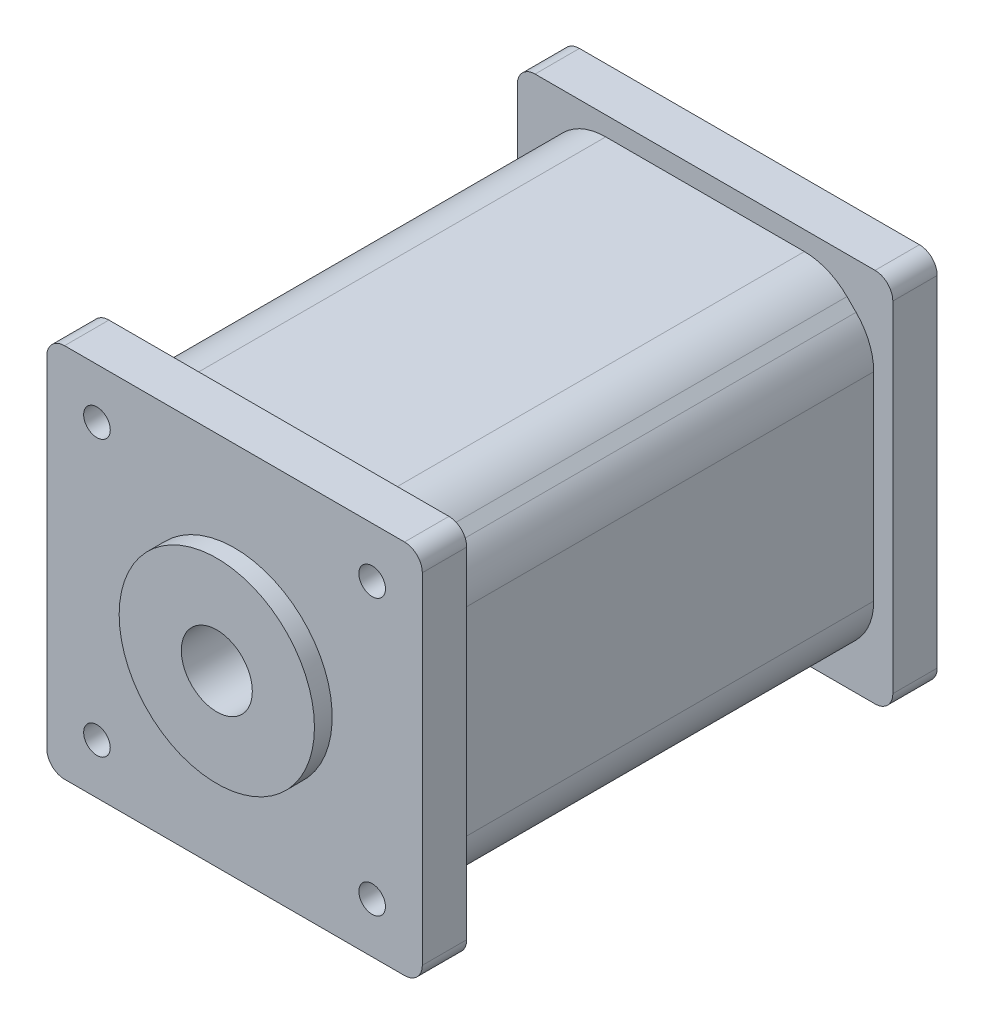
from build123d import *

# Parameters (mm, degrees)
EXTRUDE_1_DEPTH     = 5
EXTRUDE_2_DEPTH     = 48
EXTRUDE_4_DEPTH     = 5
SKETCH_4_R          = 1.5
CUT_EXTRUDE_1_DEPTH = 4.5
SKETCH_5_R          = 11
EXTRUDE_5_DEPTH     = 2
SKETCH_6_R          = 4
CUT_EXTRUDE_2_DEPTH = 20


with BuildPart() as part:
    # 草图1 → 凸台-拉伸1 (new body)
    with BuildSketch(Plane.XY):
        with BuildLine():
            Line((-19.15, -21.15), (19.15, -21.15))
            ThreePointArc((19.15, -21.15), (20.564213562, -20.564213562), (21.15, -19.15))
            Line((21.15, -19.15), (21.15, 19.15))
            ThreePointArc((21.15, 19.15), (20.564213562, 20.564213562), (19.15, 21.15))
            Line((19.15, 21.15), (-19.15, 21.15))
            ThreePointArc((-19.15, 21.15), (-20.564213562, 20.564213562), (-21.15, 19.15))
            Line((-21.15, 19.15), (-21.15, -19.15))
            ThreePointArc((-21.15, -19.15), (-20.564213562, -20.564213562), (-19.15, -21.15))
        make_face()
    extrude(amount=EXTRUDE_1_DEPTH)

    # 草图2 → 凸台-拉伸2 (add)
    with BuildSketch(Plane.XY.offset(5)):
        with BuildLine():
            Line((-17.011566207, 15.988433793), (-15.988433793, 17.011566207))
            ThreePointArc((-15.988433793, 17.011566207), (-13.785943914, 18.483222894), (-11.187929962, 19))
            Line((-11.187929962, 19), (11.187929962, 19))
            ThreePointArc((11.187929962, 19), (13.785943914, 18.483222894), (15.988433793, 17.011566207))
            Line((15.988433793, 17.011566207), (17.011566207, 15.988433793))
            ThreePointArc((17.011566207, 15.988433793), (18.483222894, 13.785943914), (19, 11.187929962))
            Line((19, 11.187929962), (19, -11.187929962))
            ThreePointArc((19, -11.187929962), (18.483222894, -13.785943914), (17.011566207, -15.988433793))
            Line((17.011566207, -15.988433793), (15.988433793, -17.011566207))
            ThreePointArc((15.988433793, -17.011566207), (13.785943914, -18.483222894), (11.187929962, -19))
            Line((11.187929962, -19), (-11.187929962, -19))
            ThreePointArc((-11.187929962, -19), (-13.785943914, -18.483222894), (-15.988433793, -17.011566207))
            Line((-15.988433793, -17.011566207), (-17.011566207, -15.988433793))
            ThreePointArc((-17.011566207, -15.988433793), (-18.483222894, -13.785943914), (-19, -11.187929962))
            Line((-19, -11.187929962), (-19, 11.187929962))
            ThreePointArc((-19, 11.187929962), (-18.483222894, 13.785943914), (-17.011566207, 15.988433793))
        make_face()
    extrude(amount=EXTRUDE_2_DEPTH)

    # 草图3 → 凸台-拉伸4 (add)
    with BuildSketch(Plane.XY.offset(53)):
        with BuildLine():
            Line((-19.15, -21.15), (19.15, -21.15))
            ThreePointArc((19.15, -21.15), (20.564213562, -20.564213562), (21.15, -19.15))
            Line((21.15, -19.15), (21.15, 19.15))
            ThreePointArc((21.15, 19.15), (20.564213562, 20.564213562), (19.15, 21.15))
            Line((19.15, 21.15), (-19.15, 21.15))
            ThreePointArc((-19.15, 21.15), (-20.564213562, 20.564213562), (-21.15, 19.15))
            Line((-21.15, 19.15), (-21.15, -19.15))
            ThreePointArc((-21.15, -19.15), (-20.564213562, -20.564213562), (-19.15, -21.15))
        make_face()
    extrude(amount=EXTRUDE_4_DEPTH)

    # 草图4 → 切除-拉伸1 (cut)
    with BuildSketch(Plane.XY.offset(58)):
        with Locations((15.5, 15.5)):
            Circle(SKETCH_4_R)
        with Locations((15.5, -15.5)):
            Circle(SKETCH_4_R)
        with Locations((-15.5, -15.5)):
            Circle(SKETCH_4_R)
        with Locations((-15.5, 15.5)):
            Circle(SKETCH_4_R)
    extrude(amount=-CUT_EXTRUDE_1_DEPTH, mode=Mode.SUBTRACT)

    # 草图5 → 凸台-拉伸5 (add)
    with BuildSketch(Plane.XY.offset(58)):
        with Locations(Location((0, 0, 0), (0, 0, 180))):
            Circle(SKETCH_5_R)
    extrude(amount=EXTRUDE_5_DEPTH)

    # 草图6 → 切除-拉伸2 (cut)
    with BuildSketch(Plane.XY.offset(60)):
        Circle(SKETCH_6_R)
    extrude(amount=-CUT_EXTRUDE_2_DEPTH, mode=Mode.SUBTRACT)


solid = part.part
